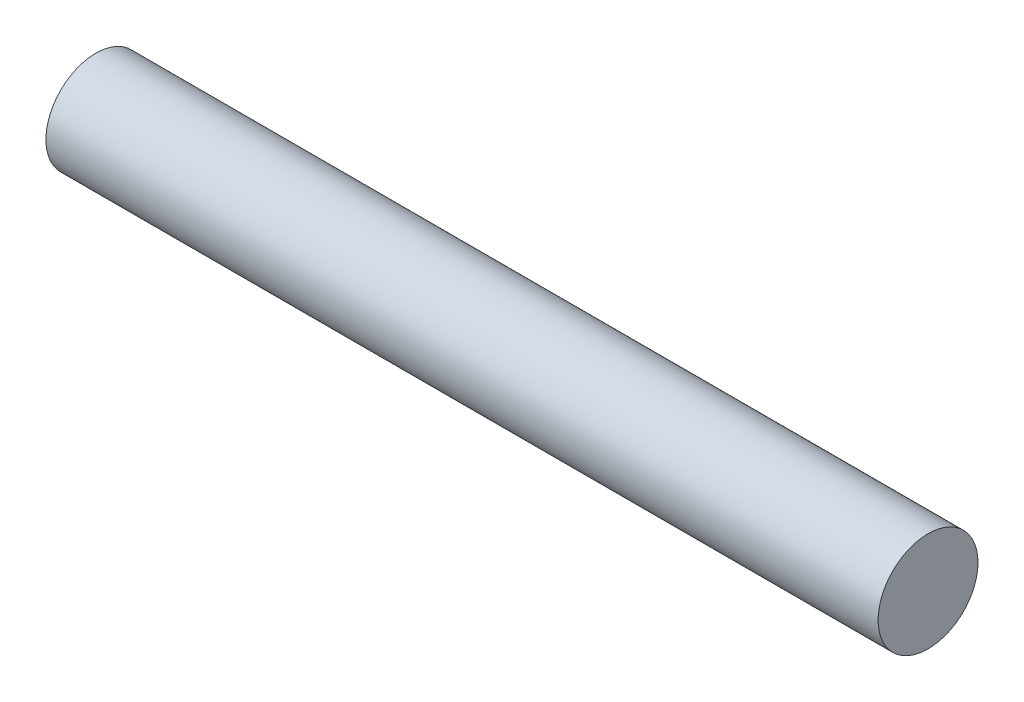
from build123d import *

# Parameters (mm, degrees)
SKETCH1_R           = 3
BOSS_EXTRUDE1_DEPTH = 50


with BuildPart() as part:
    # Sketch1 → Boss-Extrude1 (new body)
    with BuildSketch(Plane(origin=(0, 0, 0), x_dir=(0, 0, -1), z_dir=(1, 0, 0))):
        Circle(SKETCH1_R)
    extrude(amount=BOSS_EXTRUDE1_DEPTH)


solid = part.part
